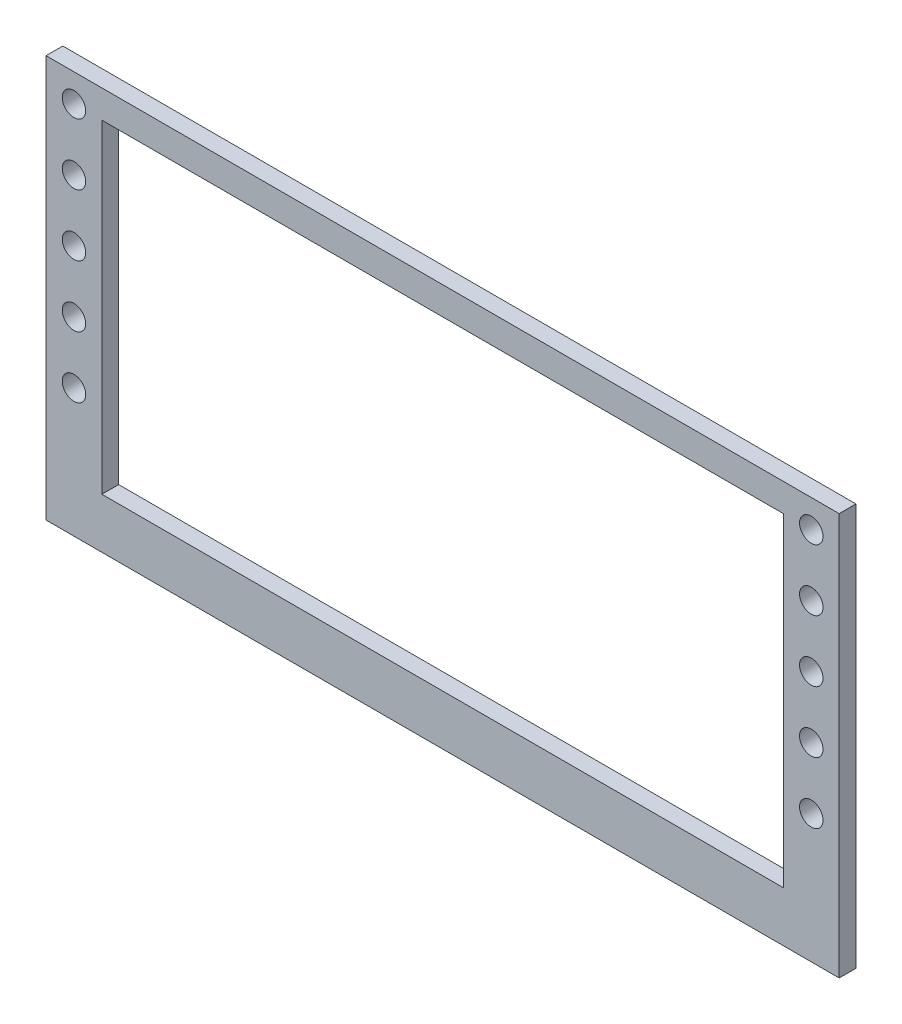
from build123d import *

# Parameters (mm, degrees)
SKETCH2_W           = 142
SKETCH2_H           = 72
SKETCH2_R           = 2.1
SKETCH2_W_2         = 122
SKETCH2_H_2         = 58
BOSS_EXTRUDE1_DEPTH = 3


with BuildPart() as part:
    # Sketch2 → Boss-Extrude1 (new body)
    with BuildSketch(Plane.XY):
        with Locations((71, 36)):
            Rectangle(SKETCH2_W, SKETCH2_H)
        with Locations((5, 67)):
            Circle(SKETCH2_R, mode=Mode.SUBTRACT)
        with Locations((5, 56)):
            Circle(SKETCH2_R, mode=Mode.SUBTRACT)
        with Locations((5, 45)):
            Circle(SKETCH2_R, mode=Mode.SUBTRACT)
        with Locations((5, 34)):
            Circle(SKETCH2_R, mode=Mode.SUBTRACT)
        with Locations((5, 23)):
            Circle(SKETCH2_R, mode=Mode.SUBTRACT)
        with Locations((137, 67)):
            Circle(SKETCH2_R, mode=Mode.SUBTRACT)
        with Locations((137, 56)):
            Circle(SKETCH2_R, mode=Mode.SUBTRACT)
        with Locations((137, 45)):
            Circle(SKETCH2_R, mode=Mode.SUBTRACT)
        with Locations((137, 34)):
            Circle(SKETCH2_R, mode=Mode.SUBTRACT)
        with Locations((137, 23)):
            Circle(SKETCH2_R, mode=Mode.SUBTRACT)
        with Locations((71, 38)):
            Rectangle(SKETCH2_W_2, SKETCH2_H_2, mode=Mode.SUBTRACT)
    extrude(amount=BOSS_EXTRUDE1_DEPTH)


solid = part.part
